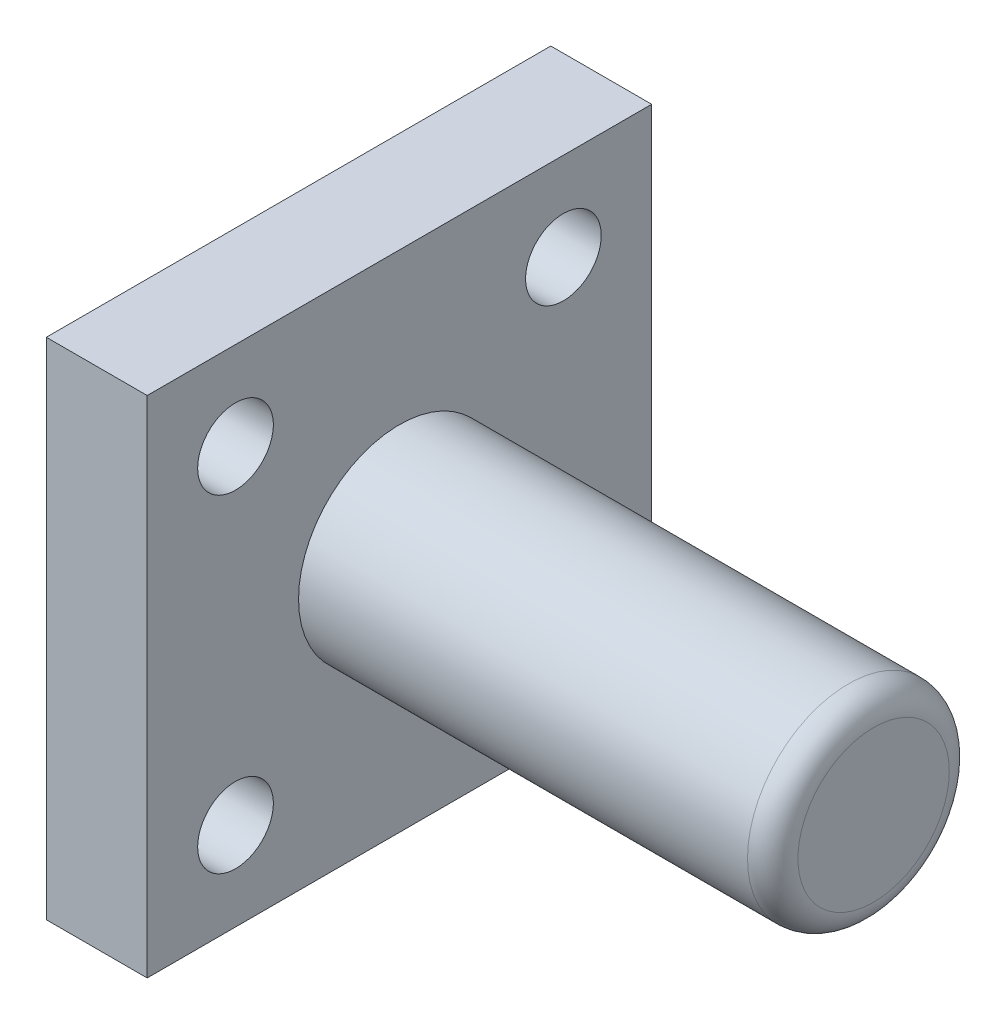
from build123d import *

# Parameters (mm, degrees)
SKETCH1_W             = 20
SKETCH1_H             = 20
BOSS_EXTRUDE1_DEPTH   = 4
SKETCH2_R             = 4
BOSS_EXTRUDE2_DEPTH   = 18.8
F_3_0MM_DOWEL_HOLE1_D = 3
FILLET1_R             = 1


with BuildPart() as part:
    # Sketch1 → Boss-Extrude1 (new body)
    with BuildSketch(Plane(origin=(0, 0, 0), x_dir=(0, 0, -1), z_dir=(1, 0, 0))):
        Rectangle(SKETCH1_W, SKETCH1_H)
    extrude(amount=BOSS_EXTRUDE1_DEPTH)

    # Sketch2 → Boss-Extrude2 (add)
    with BuildSketch(Plane(origin=(4, 0, 0), x_dir=(0, 0, -1), z_dir=(1, 0, 0))):
        with Locations(Location((0, 0, 0), (0, 0, 180))):
            Circle(SKETCH2_R)
    extrude(amount=BOSS_EXTRUDE2_DEPTH)

    # Ø3.0mm Dowel Hole1 (through all)
    with Locations(Plane.ZY):
        with Locations((-6.5, -6.5), (-6.5, 6.5), (6.5, 6.5), (6.5, -6.5)):
            Hole(F_3_0MM_DOWEL_HOLE1_D / 2)

    # Fillet1
    fillet1_edges = [part.edges().sort_by_distance(p)[0] for p in [
        (22.8, 0, -4),
    ]]
    fillet(fillet1_edges, radius=FILLET1_R)


solid = part.part
